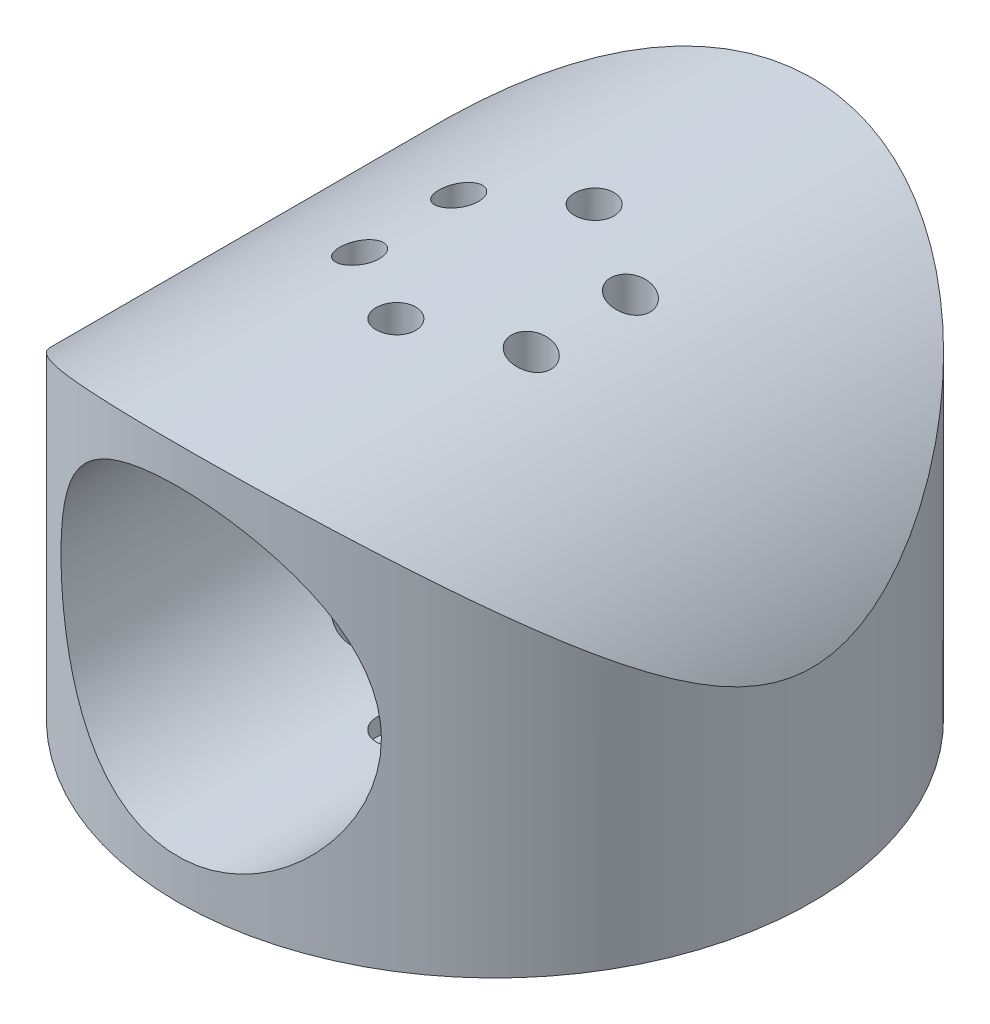
from build123d import *
from build123d.topology import SkipClean

# Parameters (mm, degrees)
SKETCH_1_R           = 45
SKETCH_1_R_2         = 40
EXTRUDE_1_DEPTH      = 17
EXTRUDE_3_DEPTH      = 45
EXTRUDE_3_DEPTH_BACK = 45
SKETCH_4_R           = 20.2
CUT_EXTRUDE_1_DEPTH  = 81.932070281
SKETCH_6_R           = 1.5
CUT_EXTRUDE_3_DEPTH  = 4.8
SKETCH_7_R           = 45
CUT_EXTRUDE_5_DEPTH  = 17
SKETCH_8_R           = 45
SKETCH_8_R_2         = 40
CUT_EXTRUDE_6_DEPTH  = 81.932070454
SKETCH_9_R           = 1.5
CUT_EXTRUDE_7_DEPTH  = 76.498344525
SKETCH_10_R          = 2.5
CUT_EXTRUDE_8_DEPTH  = 74.545904212


with BuildPart() as part:
    # 草图1 → 凸台-拉伸1 (new body)
    with BuildSketch(Plane(origin=(0, 0, 0), x_dir=(1, 0, 0), z_dir=(0, 1, 0))):
        with Locations(Location((0, 0, 0), (0, 0, 270))):
            Circle(SKETCH_1_R)
        with Locations(Location((0, 0, 0), (0, 0, 270))):
            Circle(SKETCH_1_R_2, mode=Mode.SUBTRACT)
    extrude(amount=EXTRUDE_1_DEPTH)

    # 草图4 → 凸台-拉伸3 (add, two sides: drawn at the far end of the back side and taken through both)
    with BuildSketch(Plane.XY.offset(-EXTRUDE_3_DEPTH_BACK)):
        with BuildLine():
            Line((-45, 22), (-45, 17))
            Line((-45, 17), (45, 17))
            Line((45, 17), (45, 22))
            ThreePointArc((45, 22), (0, 67), (-45, 22))
        make_face()
        with Locations((0, 42.2)):
            Circle(SKETCH_4_R, mode=Mode.SUBTRACT)
    extrude(amount=EXTRUDE_3_DEPTH + EXTRUDE_3_DEPTH_BACK)

    # 草图5 → 切除-拉伸1 (cut, through all)
    with SkipClean():  # the faces are left unmerged after this step: merging them gives an invalid solid
        with BuildSketch(Plane.XZ.offset(-17)):
            with BuildLine():
                Line((-45, -3e-08), (-45, -45))
                Line((-45, -45), (2.2e-08, -45))
                ThreePointArc((2.2e-08, -45), (-31.819805135, -31.819805172), (-45, -3e-08))
            make_face()
            with BuildLine():
                ThreePointArc((45, 0), (31.819805161, -31.819805146), (2.2e-08, -45))
                Line((2.2e-08, -45), (45, -45))
                Line((45, -45), (45, 0))
            make_face()
            with BuildLine():
                Line((-45, 45), (-45, -3e-08))
                ThreePointArc((-45, -3e-08), (-31.819805144, 31.819805163), (5.6e-08, 45))
                Line((5.6e-08, 45), (-45, 45))
            make_face()
            with BuildLine():
                ThreePointArc((5.6e-08, 45), (31.819805173, 31.819805133), (45, 0))
                Line((45, 0), (45, 45))
                Line((45, 45), (5.6e-08, 45))
            make_face()
        extrude(amount=-CUT_EXTRUDE_1_DEPTH, mode=Mode.SUBTRACT)

    # 草图6 → 切除-拉伸3 (cut)
    with SkipClean():  # the faces are left unmerged after this step: merging them gives an invalid solid
        with BuildSketch(Plane.XZ.offset(-17)):
            with Locations(Location((-5.1, -8.833459119, 0), (0, 0, 270))):
                Circle(SKETCH_6_R)
            with Locations(Location((10.2, 0, 0), (0, 0, 90))):
                Circle(SKETCH_6_R)
            with Locations(Location((-5.1, 8.833459119, 0), (0, 0, 90))):
                Circle(SKETCH_6_R)
        extrude(amount=-CUT_EXTRUDE_3_DEPTH, mode=Mode.SUBTRACT)

    # 草图7 → 切除-拉伸5 (cut)
    with BuildSketch(Plane.XZ):
        with Locations(Location((0, 0, 0), (0, 0, 270))):
            Circle(SKETCH_7_R)
    extrude(amount=-CUT_EXTRUDE_5_DEPTH, mode=Mode.SUBTRACT)

    # 草图8 → 切除-拉伸6 (cut, through all)
    with BuildSketch(Plane.XZ.offset(-17)):
        Circle(SKETCH_8_R)
        with Locations(Location((0, 0, 0), (0, 0, 270))):
            Circle(SKETCH_8_R_2, mode=Mode.SUBTRACT)
    extrude(amount=-CUT_EXTRUDE_6_DEPTH, mode=Mode.SUBTRACT)

    # 草图9 → 切除-拉伸7 (cut, through all)
    with BuildSketch(Plane.XZ.offset(-17)):
        with Locations(Location((10.825317547, 6.25, 0), (0, 0, 270))):
            Circle(SKETCH_9_R)
        with Locations(Location((-10.825317547, 6.25, 0), (0, 0, 270))):
            Circle(SKETCH_9_R)
        with Locations(Location((-10.825317547, -6.25, 0), (0, 0, 270))):
            Circle(SKETCH_9_R)
        with Locations(Location((10.825317547, -6.25, 0), (0, 0, 270))):
            Circle(SKETCH_9_R)
        with Locations(Location((0, 12.5, 0), (0, 0, 270))):
            Circle(SKETCH_9_R)
        with Locations(Location((0, -12.5, 0), (0, 0, 270))):
            Circle(SKETCH_9_R)
    extrude(amount=-CUT_EXTRUDE_7_DEPTH, mode=Mode.SUBTRACT)

    # 草图10 → 切除-拉伸8 (cut, through all)
    with BuildSketch(Plane.XZ.offset(-20)):
        with Locations(Location((0, 12.5, 0), (0, 0, 270))):
            Circle(SKETCH_10_R)
        with Locations(Location((10.825317547, 6.25, 0), (0, 0, 270))):
            Circle(SKETCH_10_R)
        with Locations(Location((10.825317547, -6.25, 0), (0, 0, 270))):
            Circle(SKETCH_10_R)
        with Locations(Location((0, -12.5, 0), (0, 0, 270))):
            Circle(SKETCH_10_R)
        with Locations(Location((-10.825317547, 6.25, 0), (0, 0, 270))):
            Circle(SKETCH_10_R)
        with Locations(Location((-10.825317547, -6.25, 0), (0, 0, 270))):
            Circle(SKETCH_10_R)
    extrude(amount=-CUT_EXTRUDE_8_DEPTH, mode=Mode.SUBTRACT)


solid = part.part
